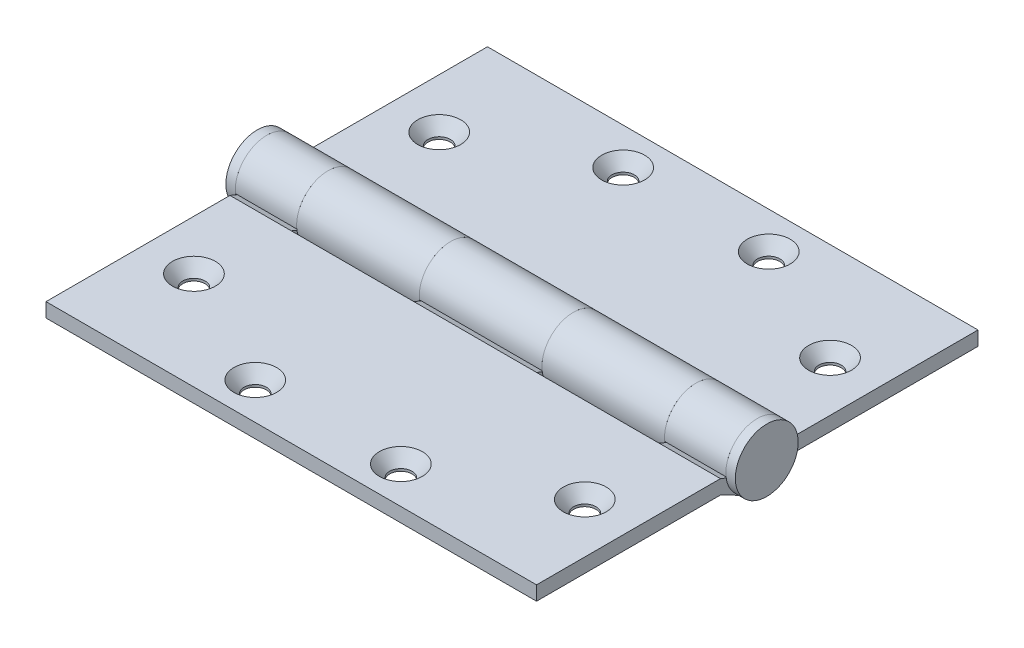
from build123d import *

# Parameters (mm, degrees)
LEFT_LEAF_DEPTH                              = 63.5
CUT_EXTRUDE1_DEPTH                           = 86.817049466
CUT_EXTRUDE1_DEPTH_BACK                      = 86.817049466
SKETCH2_W                                    = 31.75
SKETCH2_H                                    = 17.6609375
RIGHT_LEAF_DEPTH                             = 31.75
EXTRUDE3_START                               = -63.5
SKETCH4_W                                    = 47.625
SKETCH4_H                                    = 3.683
EXTRUDE3_DEPTH                               = 127
SKETCH6_W                                    = 127
SKETCH6_H                                    = 4.1671875
SKETCH7_W                                    = 2.455333333
SKETCH7_H                                    = 8.1359375
CSK_FOR_12_FLAT_HEAD_MACHINE_SCREW1_AT_COUNT = 2
CSK_FOR_12_FLAT_HEAD_MACHINE_SCREW1_AT_PITCH = 95.25
CSK_FOR_12_FLAT_HEAD_MACHINE_SCREW1_2_COUNT  = 2
CSK_FOR_12_FLAT_HEAD_MACHINE_SCREW1_2_PITCH  = 102.437151371
CSK_FOR_12_FLAT_HEAD_MACHINE_SCREW1_3_COUNT  = 2
CSK_FOR_12_FLAT_HEAD_MACHINE_SCREW1_3_PITCH  = 37.6936
CSK_FOR_12_FLAT_HEAD_MACHINE_SCREW1_4_COUNT  = 2
CSK_FOR_12_FLAT_HEAD_MACHINE_SCREW1_4_PITCH  = 85.489491313
CSK_FOR_12_FLAT_HEAD_MACHINE_SCREW1_5_COUNT  = 2
CSK_FOR_12_FLAT_HEAD_MACHINE_SCREW1_5_PITCH  = 105.464705973
CSK_FOR_12_FLAT_HEAD_MACHINE_SCREW1_6_COUNT  = 2
CSK_FOR_12_FLAT_HEAD_MACHINE_SCREW1_6_PITCH  = 35.497579143
CSK_FOR_12_FLAT_HEAD_MACHINE_SCREW1_7_COUNT  = 2
CSK_FOR_12_FLAT_HEAD_MACHINE_SCREW1_7_PITCH  = 71.235027942


with BuildPart() as part:
    # Sketch1 → Left Leaf (new, symmetric)
    with BuildSketch(Plane(origin=(0, 0, 0), x_dir=(0, 0, -1), z_dir=(1, 0, 0))):
        with BuildLine():
            Line((-9.525, -4.2672), (-3.704241722, -7.24376092))
            ThreePointArc((-3.704241722, -7.24376092), (6.693644471, 4.624781368), (-8.085759748, -0.902201921))
            Line((-8.085759748, -0.902201921), (-2.814787415, -3.07285266))
            ThreePointArc((-2.814787415, -3.07285266), (2.235122404, 3.517055515), (-1.58681232, -3.853242572))
            Line((-1.58681232, -3.853242572), (-9.525, -0.5842))
            Line((-9.525, -0.5842), (-57.15, -0.5842))
            Line((-57.15, -0.5842), (-57.15, -4.2672))
            Line((-57.15, -4.2672), (-9.525, -4.2672))
        make_face()
    extrude(amount=LEFT_LEAF_DEPTH, both=True)

    # Sketch2 → Cut-Extrude1 (cut, two sides: drawn at the far end of the back side and taken through both)
    with BuildSketch(Plane(origin=(0, 0, 0), x_dir=(1, 0, 0), z_dir=(0, 1, 0)).offset(-CUT_EXTRUDE1_DEPTH_BACK)):
        with Locations((31.75, -0.69453125)):
            Rectangle(SKETCH2_W, SKETCH2_H)
        with Locations((-31.75, -0.69453125)):
            Rectangle(SKETCH2_W, SKETCH2_H)
    extrude(amount=CUT_EXTRUDE1_DEPTH + CUT_EXTRUDE1_DEPTH_BACK, mode=Mode.SUBTRACT)

    # Sketch9 → CSK for #12 Flat Head Machine Screw1 (revolve, cut)
    with BuildSketch(Plane(origin=(-18.8468, -0.5842, 47.625), x_dir=(0, 0, 1), z_dir=(1, 0, 0))):
        Polygon((0, 0), (0, 7.5517375), (2.8956, 7.5517375), (2.8956, 3.068032542), (5.5626, 0), align=None)
    csk_for_12_flat_head_machine_screw1 = revolve(axis=Axis((-18.8468, 5.7658, 47.625), (0, -1, 0)), mode=Mode.SUBTRACT)

    # CSK for _12 Flat Head Machine Screw1 3: CSK for #12 Flat Head Machine Screw1 ×2
    with Locations(*[(i * CSK_FOR_12_FLAT_HEAD_MACHINE_SCREW1_3_PITCH, 0, 0) for i in range(1, CSK_FOR_12_FLAT_HEAD_MACHINE_SCREW1_3_COUNT)]):
        add(csk_for_12_flat_head_machine_screw1, mode=Mode.SUBTRACT)

    # CSK for _12 Flat Head Machine Screw1 6: CSK for #12 Flat Head Machine Screw1 ×2
    with Locations(*[Vector(-0.894427190999916, 0, -0.44721359549995804) * (i * CSK_FOR_12_FLAT_HEAD_MACHINE_SCREW1_6_PITCH) for i in range(1, CSK_FOR_12_FLAT_HEAD_MACHINE_SCREW1_6_COUNT)]):
        add(csk_for_12_flat_head_machine_screw1, mode=Mode.SUBTRACT)

    # CSK for _12 Flat Head Machine Screw1 7: CSK for #12 Flat Head Machine Screw1 ×2
    with Locations(*[Vector(0.9748518672037848, 0, -0.22285384674556183) * (i * CSK_FOR_12_FLAT_HEAD_MACHINE_SCREW1_7_PITCH) for i in range(1, CSK_FOR_12_FLAT_HEAD_MACHINE_SCREW1_7_COUNT)]):
        add(csk_for_12_flat_head_machine_screw1, mode=Mode.SUBTRACT)


with BuildPart() as body_2:
    # Sketch3 → Right Leaf (new body)
    with BuildSketch(Plane(origin=(47.625, 0, 0), x_dir=(0, 0, -1), z_dir=(1, 0, 0))):
        with BuildLine():
            Line((9.525, -4.2672), (3.704241722, -7.24376092))
            ThreePointArc((3.704241722, -7.24376092), (-6.693644471, 4.624781368), (8.085759748, -0.902201921))
            Line((8.085759748, -0.902201921), (2.814787415, -3.07285266))
            ThreePointArc((2.814787415, -3.07285266), (-2.235122404, 3.517055515), (1.58681232, -3.853242572))
            Line((1.58681232, -3.853242572), (9.525, -0.5842))
            Line((9.525, -0.5842), (57.15, -0.5842))
            Line((57.15, -0.5842), (57.15, -4.2672))
            Line((57.15, -4.2672), (9.525, -4.2672))
        make_face()
    extrude(amount=-RIGHT_LEAF_DEPTH)


with BuildPart() as body_3:
    # Mirror1: mirrored copy
    add(body_2.part.mirror(Plane(origin=(0, 0, 0), x_dir=(0, 0, 1), z_dir=(1, 0, 0))))


with BuildPart() as body_4:
    # Sketch4 → Extrude3 (new body)
    with BuildSketch(Plane.ZY.offset(EXTRUDE3_START)):
        with Locations((-33.3375, -2.4257)):
            Rectangle(SKETCH4_W, SKETCH4_H)
    extrude(amount=EXTRUDE3_DEPTH)


with BuildPart() as body_3_1:
    add(body_3.part)

    # Combine1: union body 2, body 4
    add(body_2.part)
    add(body_4.part)

    # CSK for #12 Flat Head Machine Screw1 at: CSK for #12 Flat Head Machine Screw1 ×2
    with Locations(*[(0, 0, -i * CSK_FOR_12_FLAT_HEAD_MACHINE_SCREW1_AT_PITCH) for i in range(1, CSK_FOR_12_FLAT_HEAD_MACHINE_SCREW1_AT_COUNT)]):
        add(csk_for_12_flat_head_machine_screw1, mode=Mode.SUBTRACT)

    # CSK for _12 Flat Head Machine Screw1 2: CSK for #12 Flat Head Machine Screw1 ×2
    with Locations(*[Vector(0.36796806134880755, 0, -0.9298384299582376) * (i * CSK_FOR_12_FLAT_HEAD_MACHINE_SCREW1_2_PITCH) for i in range(1, CSK_FOR_12_FLAT_HEAD_MACHINE_SCREW1_2_COUNT)]):
        add(csk_for_12_flat_head_machine_screw1, mode=Mode.SUBTRACT)

    # CSK for _12 Flat Head Machine Screw1 4: CSK for #12 Flat Head Machine Screw1 ×2
    with Locations(*[Vector(-0.37139067635410433, 0, -0.9284766908852591) * (i * CSK_FOR_12_FLAT_HEAD_MACHINE_SCREW1_4_PITCH) for i in range(1, CSK_FOR_12_FLAT_HEAD_MACHINE_SCREW1_4_COUNT)]):
        add(csk_for_12_flat_head_machine_screw1, mode=Mode.SUBTRACT)

    # CSK for _12 Flat Head Machine Screw1 5: CSK for #12 Flat Head Machine Screw1 ×2
    with Locations(*[Vector(0.6584534547302844, 0, -0.7526214506335528) * (i * CSK_FOR_12_FLAT_HEAD_MACHINE_SCREW1_5_PITCH) for i in range(1, CSK_FOR_12_FLAT_HEAD_MACHINE_SCREW1_5_COUNT)]):
        add(csk_for_12_flat_head_machine_screw1, mode=Mode.SUBTRACT)


with BuildPart() as body_3_2:
    # Sketch6 → Pin (revolve)
    with BuildSketch(Plane(origin=(0, 0, 0), x_dir=(1, 0, 0), z_dir=(0, 1, 0)), mode=Mode.PRIVATE) as pin_sk:
        with Locations((0, -2.08359375)):
            Rectangle(SKETCH6_W, SKETCH6_H)
    revolve(pin_sk.sketch.rotate(Axis((24.566181471, 0, 0), (-1, 0, 0)), 180), axis=Axis((24.566181471, 0, 0), (-1, 0, 0)))

    # Sketch7 → Spun Pin (revolve)
    with BuildSketch(Plane(origin=(0, 0, 0), x_dir=(1, 0, 0), z_dir=(0, 1, 0)), mode=Mode.PRIVATE) as spun_pin_sk:
        with Locations((-64.727666666, -4.06796875)):
            Rectangle(SKETCH7_W, SKETCH7_H)
        with Locations((64.727666666, -4.06796875)):
            Rectangle(SKETCH7_W, SKETCH7_H)
    revolve(spun_pin_sk.sketch.rotate(Axis((24.566181471, 0, 0), (-1, 0, 0)), 180), axis=Axis((24.566181471, 0, 0), (-1, 0, 0)))


solid = Compound([part.part, body_3_1.part, body_3_2.part])
